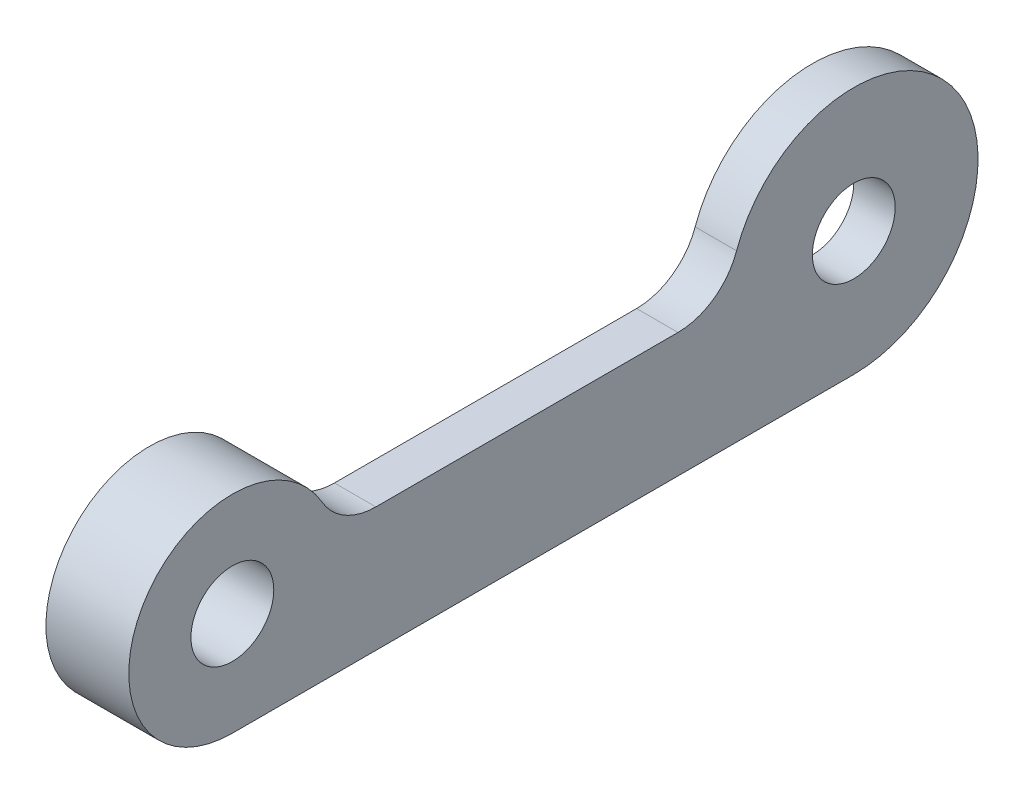
from build123d import *

# Parameters (mm, degrees)
SKETCH_1_R               = 5
SKETCH_1_R_2             = 6
SKETCH_1_W               = 30
SKETCH_1_H               = 6
EXTRUDE_1_DEPTH          = 2
EXTRUDE_START            = -2
SKETCH_1_5_R             = 5
EXTRUDE_3_DEPTH          = 2
CUT_EXTRUDE_2_DEPTH      = 37.551333765
CUT_EXTRUDE_2_DEPTH_BACK = 37.551333765
SKETCH_1_4_R             = 2
FILLET_1_R               = 3


with BuildPart() as part:
    # 草图1 → 凸台-拉伸1 (new body)
    with BuildSketch(Plane(origin=(0, 0, 0), x_dir=(0, 0, -1), z_dir=(1, 0, 0))):
        with Locations((0, -1)):
            Circle(SKETCH_1_R)
        with Locations((30, 0)):
            Circle(SKETCH_1_R_2)
        with Locations((15, -3)):
            Rectangle(SKETCH_1_W, SKETCH_1_H)
    extrude(amount=EXTRUDE_1_DEPTH)

    # 草图1<5> → 凸台-拉伸3 (add)
    with BuildSketch(Plane(origin=(0, 0, 0), x_dir=(0, 0, -1), z_dir=(1, 0, 0)).offset(EXTRUDE_START)):
        with Locations((0, -1)):
            Circle(SKETCH_1_5_R)
    extrude(amount=EXTRUDE_3_DEPTH)

    # 草图1<4> → 切除-拉伸2 (cut, two sides: drawn at the far end of the back side and taken through both)
    with BuildSketch(Plane(origin=(0, 0, 0), x_dir=(0, 0, -1), z_dir=(1, 0, 0)).offset(-CUT_EXTRUDE_2_DEPTH_BACK)):
        with Locations((0, -1)):
            Circle(SKETCH_1_4_R)
        with Locations((30, 0)):
            Circle(SKETCH_1_4_R)
    extrude(amount=CUT_EXTRUDE_2_DEPTH + CUT_EXTRUDE_2_DEPTH_BACK, mode=Mode.SUBTRACT)

    # 圆角1
    fillet_1_edges = [part.edges().sort_by_distance(p)[0] for p in [
        (1, 0, -24),
        (1, 0, -4.898979486),
    ]]
    fillet(fillet_1_edges, radius=FILLET_1_R)


solid = part.part
